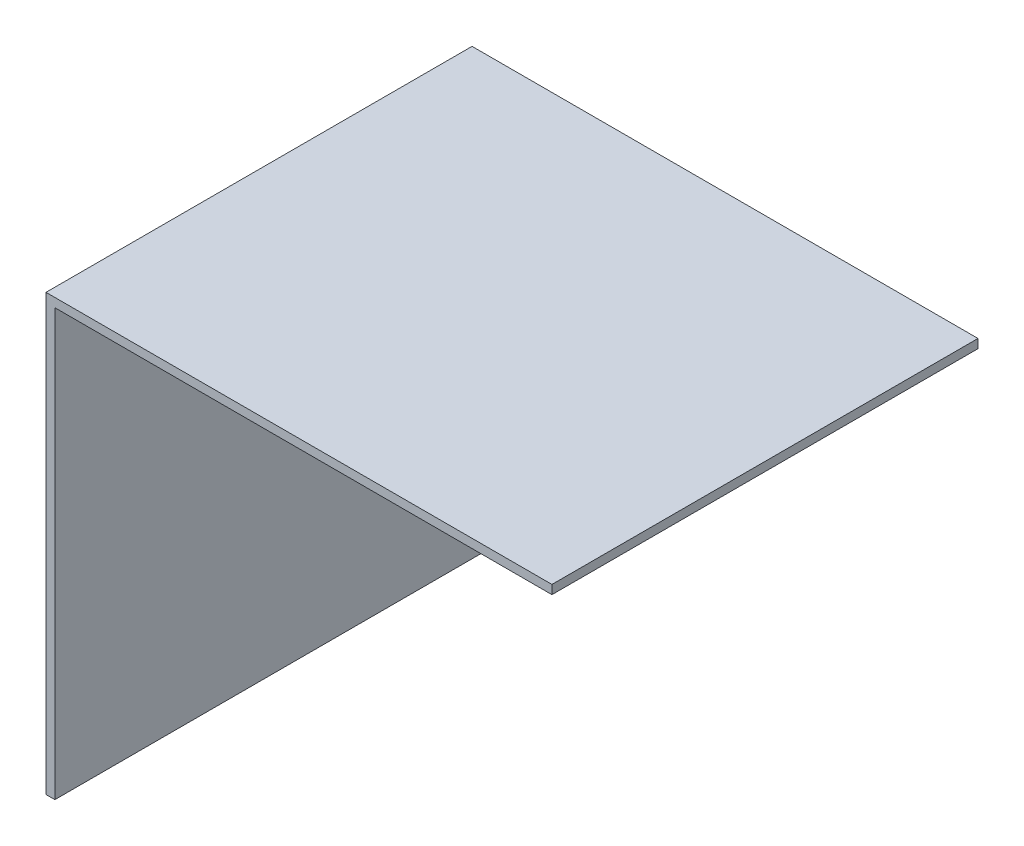
from build123d import *

# Parameters (mm, degrees)
BOSS_EXTRUDE1_DEPTH = 152.4


with BuildPart() as part:
    # Sketch1 → Boss-Extrude1 (new body)
    with BuildSketch(Plane.XY):
        Polygon((0, 155.575), (0, 0), (3.175, 0), (3.175, 152.4), (180.975, 152.4), (180.975, 155.575), align=None)
    extrude(amount=BOSS_EXTRUDE1_DEPTH)


solid = part.part
